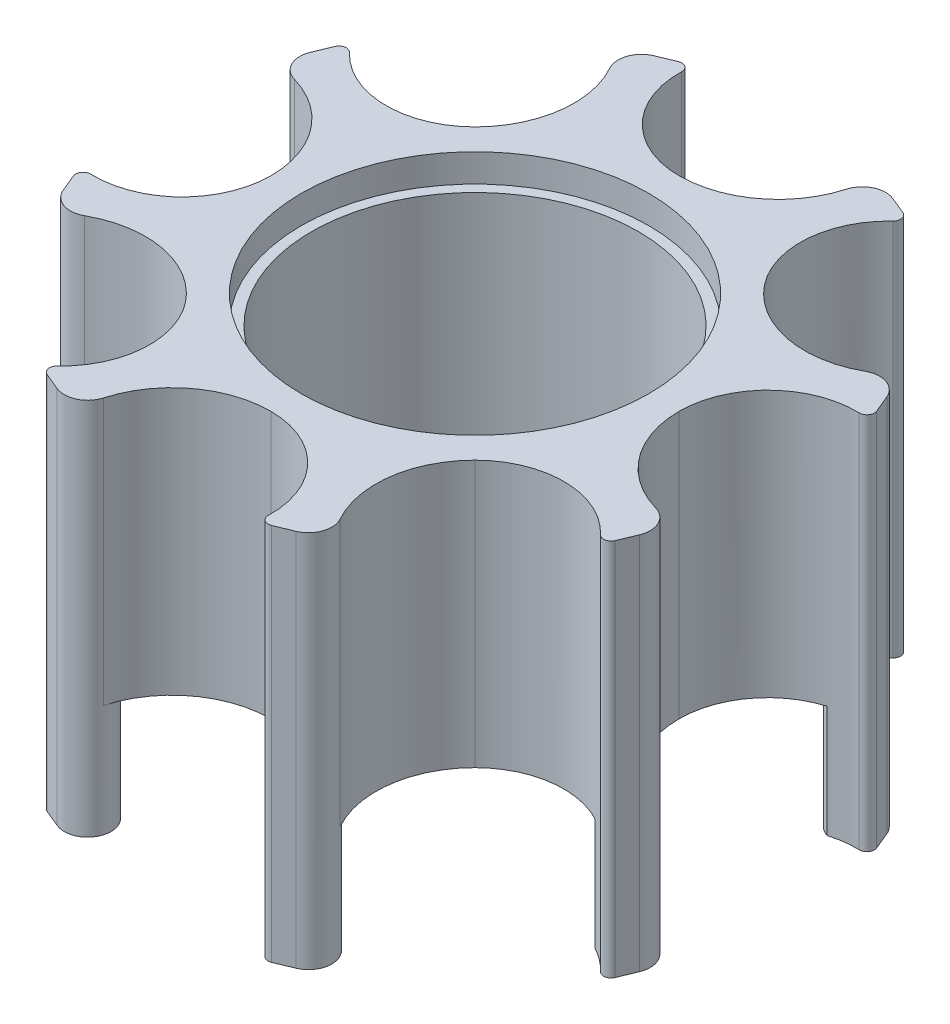
from build123d import *

# Parameters (mm, degrees)
EXTRUDE_1_DEPTH     = 35
SKETCH_5_R          = 17.5
CUT_EXTRUDE_3_DEPTH = 27.5
SKETCH_6_R          = 18.6
CUT_EXTRUDE_4_DEPTH = 3
CUT_EXTRUDE_5_DEPTH = 6.48
CUT_EXTRUDE_6_DEPTH = 55.049209838
EXTRUDE_START       = 5.52
EXTRUDE_2_DEPTH     = 5.52
SKETCH_12_R         = 1.3
CUT_EXTRUDE_7_DEPTH = 55.049209838
SKETCH_13_R         = 17.5
SKETCH_13_R_2       = 1.3
EXTRUDE_3_DEPTH     = 2


with BuildPart() as part:
    # 草图1 → 凸台-拉伸1 (new body)
    with BuildSketch(Plane(origin=(0, 0, 0), x_dir=(1, 0, 0), z_dir=(0, 1, 0))):
        with BuildLine():
            Line((13.565756947, 31.180270004), (15.409458345, 30.41658388))
            ThreePointArc((15.409458345, 30.41658388), (15.890161366, 29.821935938), (15.652026017, 29.095318346))
            ThreePointArc((15.652026017, 29.095318346), (12.665907923, 22.315459341), (15.450283169, 15.450283169))
            ThreePointArc((15.450283169, 15.450283169), (21.486135899, 12.444530691), (28.114304746, 13.682853695))
            ThreePointArc((28.114304746, 13.682853695), (30.152483097, 13.859644928), (31.640219088, 12.45534163))
            Line((31.640219088, 12.45534163), (32.403905212, 10.611640232))
            ThreePointArc((32.403905212, 10.611640232), (32.323333986, 9.851252274), (31.641150639, 9.505843167))
            ThreePointArc((31.641150639, 9.505843167), (24.735562008, 6.823263243), (21.85, 0))
            ThreePointArc((21.85, 0), (23.992604436, -6.393380355), (29.555054168, -10.2045769))
            ThreePointArc((29.555054168, -10.2045769), (31.121274181, -11.520776354), (31.180270004, -13.565756947))
            Line((31.180270004, -13.565756947), (30.41658388, -15.409458345))
            ThreePointArc((30.41658388, -15.409458345), (29.821935938, -15.890161366), (29.095318346, -15.652026017))
            ThreePointArc((29.095318346, -15.652026017), (22.315459341, -12.665907923), (15.450283169, -15.450283169))
            ThreePointArc((15.450283169, -15.450283169), (12.444530691, -21.486135899), (13.682853695, -28.114304746))
            ThreePointArc((13.682853695, -28.114304746), (13.859644928, -30.152483097), (12.45534163, -31.640219088))
            Line((12.45534163, -31.640219088), (10.611640232, -32.403905212))
            ThreePointArc((10.611640232, -32.403905212), (9.851252274, -32.323333986), (9.505843167, -31.641150639))
            ThreePointArc((9.505843167, -31.641150639), (6.823263243, -24.735562008), (0, -21.85))
            ThreePointArc((0, -21.85), (-6.393380355, -23.992604436), (-10.2045769, -29.555054168))
            ThreePointArc((-10.2045769, -29.555054168), (-11.520776354, -31.121274181), (-13.565756947, -31.180270004))
            Line((-13.565756947, -31.180270004), (-15.409458345, -30.41658388))
            ThreePointArc((-15.409458345, -30.41658388), (-15.890161366, -29.821935938), (-15.652026017, -29.095318346))
            ThreePointArc((-15.652026017, -29.095318346), (-12.665907923, -22.315459341), (-15.450283169, -15.450283169))
            ThreePointArc((-15.450283169, -15.450283169), (-21.486135899, -12.444530691), (-28.114304746, -13.682853695))
            ThreePointArc((-28.114304746, -13.682853695), (-30.152483097, -13.859644928), (-31.640219088, -12.45534163))
            Line((-31.640219088, -12.45534163), (-32.403905212, -10.611640232))
            ThreePointArc((-32.403905212, -10.611640232), (-32.323333986, -9.851252274), (-31.641150639, -9.505843167))
            ThreePointArc((-31.641150639, -9.505843167), (-24.735562008, -6.823263243), (-21.85, 0))
            ThreePointArc((-21.85, 0), (-23.992604436, 6.393380355), (-29.555054168, 10.2045769))
            ThreePointArc((-29.555054168, 10.2045769), (-31.121274181, 11.520776354), (-31.180270004, 13.565756947))
            Line((-31.180270004, 13.565756947), (-30.41658388, 15.409458345))
            ThreePointArc((-30.41658388, 15.409458345), (-29.821935938, 15.890161366), (-29.095318346, 15.652026017))
            ThreePointArc((-29.095318346, 15.652026017), (-22.315459341, 12.665907923), (-15.450283169, 15.450283169))
            ThreePointArc((-15.450283169, 15.450283169), (-12.444530691, 21.486135899), (-13.682853695, 28.114304746))
            ThreePointArc((-13.682853695, 28.114304746), (-13.859644928, 30.152483097), (-12.45534163, 31.640219088))
            Line((-12.45534163, 31.640219088), (-10.611640232, 32.403905212))
            ThreePointArc((-10.611640232, 32.403905212), (-9.851252274, 32.323333986), (-9.505843167, 31.641150639))
            ThreePointArc((-9.505843167, 31.641150639), (-6.823263243, 24.735562008), (0, 21.85))
            ThreePointArc((0, 21.85), (6.393380355, 23.992604436), (10.2045769, 29.555054168))
            ThreePointArc((10.2045769, 29.555054168), (11.520776354, 31.121274181), (13.565756947, 31.180270004))
        make_face()
    extrude(amount=EXTRUDE_1_DEPTH)

    # 草图5 → 切除-拉伸3 (cut)
    with BuildSketch(Plane(origin=(0, 35, 0), x_dir=(1, 0, 0), z_dir=(0, 1, 0))):
        with Locations(Location((0, 0, 0), (0, 0, 270))):
            Circle(SKETCH_5_R)
    extrude(amount=-CUT_EXTRUDE_3_DEPTH, mode=Mode.SUBTRACT)

    # 草图6 → 切除-拉伸4 (cut)
    with BuildSketch(Plane(origin=(0, 35, 0), x_dir=(1, 0, 0), z_dir=(0, 1, 0))):
        with Locations(Location((0, 0, 0), (0, 0, 270))):
            Circle(SKETCH_6_R)
    extrude(amount=-CUT_EXTRUDE_4_DEPTH, mode=Mode.SUBTRACT)

    # 草图7 → 切除-拉伸5 (cut)
    with BuildSketch(Plane.XZ):
        with BuildLine():
            ThreePointArc((9.10421468, 28.61165958), (11.228658553, 26.845140252), (13.682853695, 28.114304746))
            ThreePointArc((13.682853695, 28.114304746), (12.444530691, 21.486135899), (15.450283169, 15.450283169))
            ThreePointArc((15.450283169, 15.450283169), (20.785800914, 12.766861919), (26.669150448, 13.793846573))
            ThreePointArc((26.669150448, 13.793846573), (26.92224132, 11.042520107), (29.555054168, 10.2045769))
            ThreePointArc((29.555054168, 10.2045769), (23.992604436, 6.393380355), (21.85, 0))
            ThreePointArc((21.85, 0), (23.725315416, -5.670246141), (28.61165958, -9.10421468))
            ThreePointArc((28.61165958, -9.10421468), (26.845140252, -11.228658553), (28.114304746, -13.682853695))
            ThreePointArc((28.114304746, -13.682853695), (21.486135899, -12.444530691), (15.450283169, -15.450283169))
            ThreePointArc((15.450283169, -15.450283169), (12.766861919, -20.785800914), (13.793846573, -26.669150448))
            ThreePointArc((13.793846573, -26.669150448), (11.042520107, -26.92224132), (10.2045769, -29.555054168))
            ThreePointArc((10.2045769, -29.555054168), (6.393380355, -23.992604436), (0, -21.85))
            ThreePointArc((0, -21.85), (-5.670246141, -23.725315416), (-9.10421468, -28.61165958))
            ThreePointArc((-9.10421468, -28.61165958), (-11.228658553, -26.845140252), (-13.682853695, -28.114304746))
            ThreePointArc((-13.682853695, -28.114304746), (-12.444530691, -21.486135899), (-15.450283169, -15.450283169))
            ThreePointArc((-15.450283169, -15.450283169), (-20.785800914, -12.766861919), (-26.669150448, -13.793846573))
            ThreePointArc((-26.669150448, -13.793846573), (-26.92224132, -11.042520107), (-29.555054168, -10.2045769))
            ThreePointArc((-29.555054168, -10.2045769), (-23.992604436, -6.393380355), (-21.85, 0))
            ThreePointArc((-21.85, 0), (-23.725315416, 5.670246141), (-28.61165958, 9.10421468))
            ThreePointArc((-28.61165958, 9.10421468), (-26.845140252, 11.228658553), (-28.114304746, 13.682853695))
            ThreePointArc((-28.114304746, 13.682853695), (-21.486135899, 12.444530691), (-15.450283169, 15.450283169))
            ThreePointArc((-15.450283169, 15.450283169), (-12.766861919, 20.785800914), (-13.793846573, 26.669150448))
            ThreePointArc((-13.793846573, 26.669150448), (-11.042520107, 26.92224132), (-10.2045769, 29.555054168))
            ThreePointArc((-10.2045769, 29.555054168), (-6.393380355, 23.992604436), (0, 21.85))
            ThreePointArc((0, 21.85), (5.670246141, 23.725315416), (9.10421468, 28.61165958))
        make_face()
    extrude(amount=-CUT_EXTRUDE_5_DEPTH, mode=Mode.SUBTRACT)

    # 草图8 → 切除-拉伸6 (cut, through all)
    with BuildSketch(Plane.XZ.offset(-6.48)):
        with BuildLine():
            Line((1.833030278, 2.5), (-1.833030278, 2.5))
            ThreePointArc((-1.833030278, 2.5), (0, -3.1), (1.833030278, 2.5))
        make_face()
    extrude(amount=-CUT_EXTRUDE_6_DEPTH, mode=Mode.SUBTRACT)

    # 草图11 → 凸台-拉伸2 (add)
    with BuildSketch(Plane.XZ.offset(EXTRUDE_START)):
        with BuildLine():
            Line((31.640219088, -12.45534163), (32.403905212, -10.611640232))
            ThreePointArc((32.403905212, -10.611640232), (32.323333986, -9.851252274), (31.641150639, -9.505843167))
            ThreePointArc((31.641150639, -9.505843167), (30.110166925, -9.427513844), (28.61165958, -9.10421468))
            ThreePointArc((28.61165958, -9.10421468), (27.475741438, -13.174877522), (31.640219088, -12.45534163))
        make_face()
        with BuildLine():
            Line((31.180270004, 13.565756947), (30.41658388, 15.409458345))
            ThreePointArc((30.41658388, 15.409458345), (29.821935938, 15.890161366), (29.095318346, 15.652026017))
            ThreePointArc((29.095318346, 15.652026017), (27.957362185, 14.624844247), (26.669150448, 13.793846573))
            ThreePointArc((26.669150448, 13.793846573), (28.744328326, 10.112237852), (31.180270004, 13.565756947))
        make_face()
        with BuildLine():
            Line((12.45534163, 31.640219088), (10.611640232, 32.403905212))
            ThreePointArc((10.611640232, 32.403905212), (9.851252274, 32.323333986), (9.505843167, 31.641150639))
            ThreePointArc((9.505843167, 31.641150639), (9.427513844, 30.110166925), (9.10421468, 28.61165958))
            ThreePointArc((9.10421468, 28.61165958), (13.174877522, 27.475741438), (12.45534163, 31.640219088))
        make_face()
        with BuildLine():
            Line((-13.565756947, 31.180270004), (-15.409458345, 30.41658388))
            ThreePointArc((-15.409458345, 30.41658388), (-15.890161366, 29.821935938), (-15.652026017, 29.095318346))
            ThreePointArc((-15.652026017, 29.095318346), (-14.624844247, 27.957362185), (-13.793846573, 26.669150448))
            ThreePointArc((-13.793846573, 26.669150448), (-10.112237852, 28.744328326), (-13.565756947, 31.180270004))
        make_face()
        with BuildLine():
            Line((-31.640219088, 12.45534163), (-32.403905212, 10.611640232))
            ThreePointArc((-32.403905212, 10.611640232), (-32.323333986, 9.851252274), (-31.641150639, 9.505843167))
            ThreePointArc((-31.641150639, 9.505843167), (-30.110166925, 9.427513844), (-28.61165958, 9.10421468))
            ThreePointArc((-28.61165958, 9.10421468), (-27.475741438, 13.174877522), (-31.640219088, 12.45534163))
        make_face()
        with BuildLine():
            Line((-31.180270004, -13.565756947), (-30.41658388, -15.409458345))
            ThreePointArc((-30.41658388, -15.409458345), (-29.821935938, -15.890161366), (-29.095318346, -15.652026017))
            ThreePointArc((-29.095318346, -15.652026017), (-27.957362185, -14.624844247), (-26.669150448, -13.793846573))
            ThreePointArc((-26.669150448, -13.793846573), (-28.744328326, -10.112237852), (-31.180270004, -13.565756947))
        make_face()
        with BuildLine():
            Line((-12.45534163, -31.640219088), (-10.611640232, -32.403905212))
            ThreePointArc((-10.611640232, -32.403905212), (-9.851252274, -32.323333986), (-9.505843167, -31.641150639))
            ThreePointArc((-9.505843167, -31.641150639), (-9.427513844, -30.110166925), (-9.10421468, -28.61165958))
            ThreePointArc((-9.10421468, -28.61165958), (-13.174877522, -27.475741438), (-12.45534163, -31.640219088))
        make_face()
        with BuildLine():
            Line((13.565756947, -31.180270004), (15.409458345, -30.41658388))
            ThreePointArc((15.409458345, -30.41658388), (15.890161366, -29.821935938), (15.652026017, -29.095318346))
            ThreePointArc((15.652026017, -29.095318346), (14.624844247, -27.957362185), (13.793846573, -26.669150448))
            ThreePointArc((13.793846573, -26.669150448), (10.112237852, -28.744328326), (13.565756947, -31.180270004))
        make_face()
    extrude(amount=-EXTRUDE_2_DEPTH)

    # 草图12 → 切除-拉伸7 (cut, through all)
    with BuildSketch(Plane.XZ.offset(-6.48)):
        with Locations(Location((10, 0, 0), (0, 0, 270))):
            Circle(SKETCH_12_R)
        with Locations(Location((0, -10, 0), (0, 0, 270))):
            Circle(SKETCH_12_R)
        with Locations(Location((-10, 0, 0), (0, 0, 270))):
            Circle(SKETCH_12_R)
    extrude(amount=-CUT_EXTRUDE_7_DEPTH, mode=Mode.SUBTRACT)

    # 草图13 → 凸台-拉伸3 (add)
    with BuildSketch(Plane(origin=(0, 7.5, 0), x_dir=(1, 0, 0), z_dir=(0, 1, 0))):
        with Locations(Location((0, 0, 0), (0, 0, 270))):
            Circle(SKETCH_13_R)
        with Locations(Location((-10, 0, 0), (0, 0, 90))):
            Circle(SKETCH_13_R_2, mode=Mode.SUBTRACT)
        with Locations(Location((0, 10, 0), (0, 0, 90))):
            Circle(SKETCH_13_R_2, mode=Mode.SUBTRACT)
        with Locations(Location((10, 0, 0), (0, 0, 90))):
            Circle(SKETCH_13_R_2, mode=Mode.SUBTRACT)
        with BuildLine():
            Line((-1.833030278, -2.5), (1.833030278, -2.5))
            ThreePointArc((1.833030278, -2.5), (0, 3.1), (-1.833030278, -2.5))
        make_face(mode=Mode.SUBTRACT)
    extrude(amount=EXTRUDE_3_DEPTH)


solid = part.part
